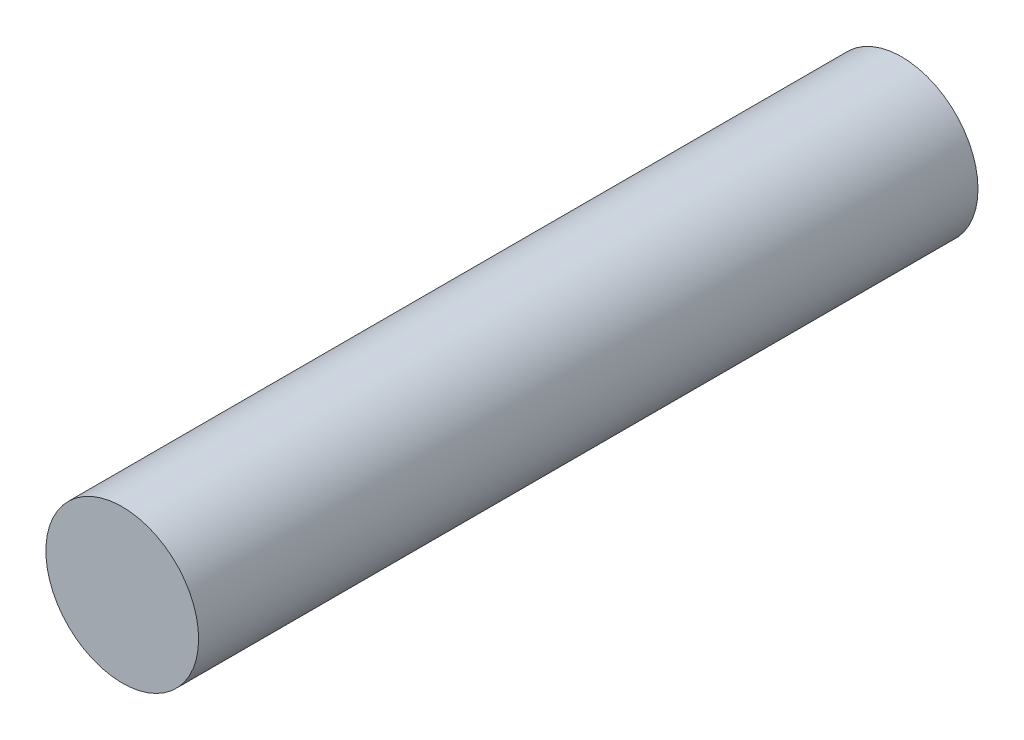
from build123d import *

# Parameters (mm, degrees)
SKETCH1_R           = 99.965
BOSS_EXTRUDE1_DEPTH = 1020


with BuildPart() as part:
    # Sketch1 → Boss-Extrude1 (new body)
    with BuildSketch(Plane.XY):
        Circle(SKETCH1_R)
    extrude(amount=BOSS_EXTRUDE1_DEPTH)


solid = part.part
